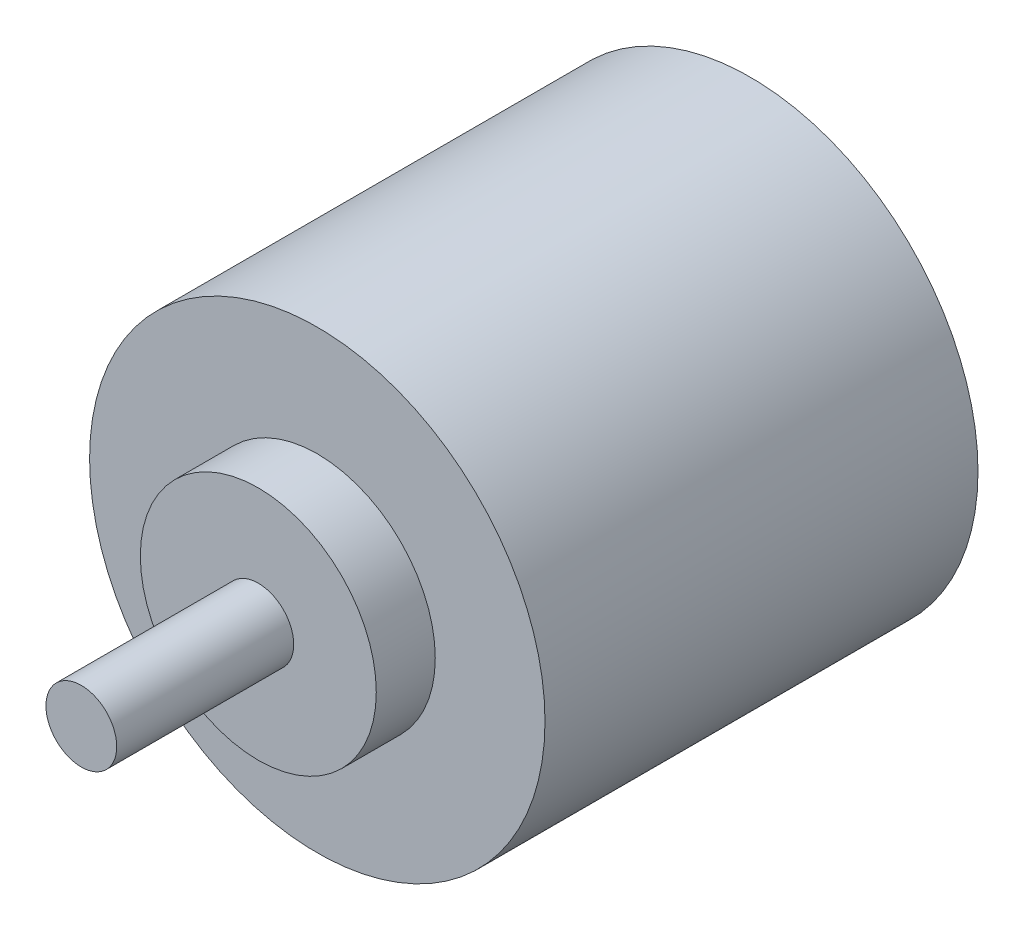
from build123d import *

# Parameters (mm, degrees)
SKETCH1_R           = 19.3
BOSS_EXTRUDE1_DEPTH = 36.7
SKETCH3_R           = 10
BOSS_EXTRUDE2_DEPTH = 5
SKETCH4_R           = 3
BOSS_EXTRUDE3_DEPTH = 15


with BuildPart() as part:
    # Sketch1 → Boss-Extrude1 (new body)
    with BuildSketch(Plane.XY):
        with Locations((-14.127422454, 5.37928778)):
            Circle(SKETCH1_R)
    extrude(amount=BOSS_EXTRUDE1_DEPTH)

    # Sketch3 → Boss-Extrude2 (add)
    with BuildSketch(Plane.XY.offset(36.7)):
        with Locations((-14.127422454, 5.37928778)):
            Circle(SKETCH3_R)
    extrude(amount=BOSS_EXTRUDE2_DEPTH)

    # Sketch4 → Boss-Extrude3 (add)
    with BuildSketch(Plane.XY.offset(41.7)):
        with Locations((-14.127422454, 5.37928778)):
            Circle(SKETCH4_R)
    extrude(amount=BOSS_EXTRUDE3_DEPTH)


solid = part.part
